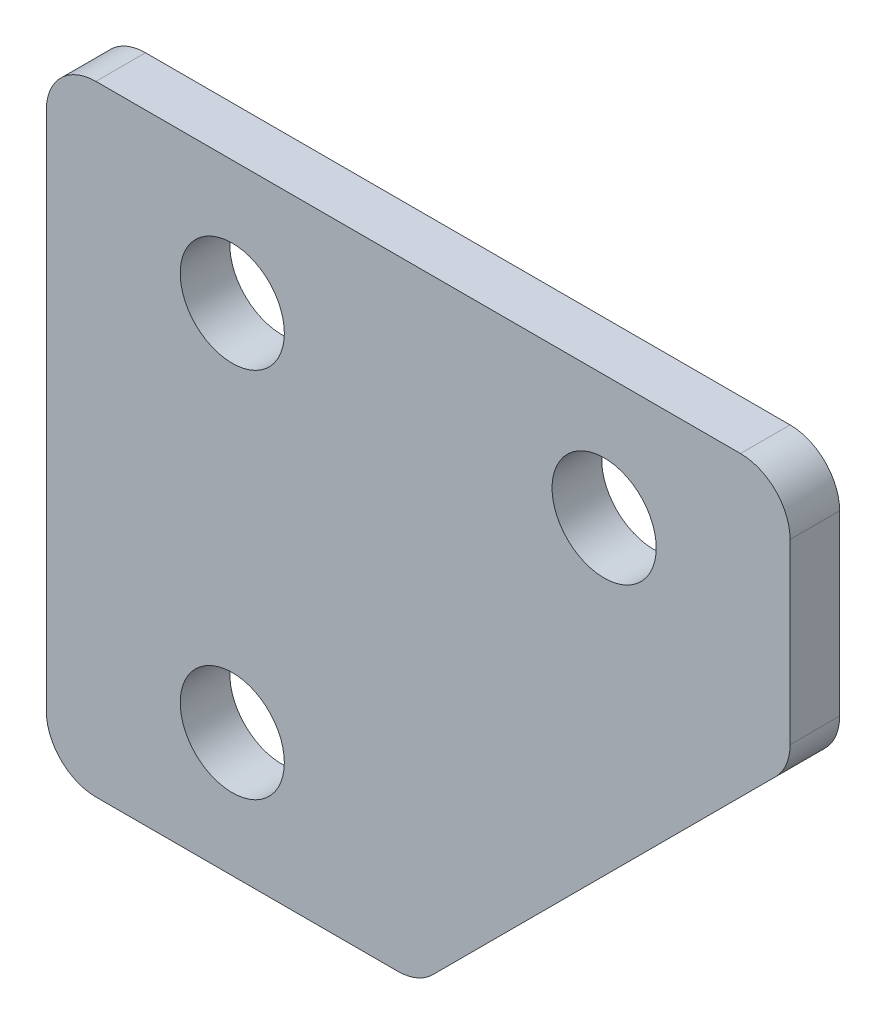
from build123d import *

# Parameters (mm, degrees)
SKETCH_1_W      = 15
SKETCH_1_H      = 25
SKETCH_1_R      = 2.1
SKETCH_1_H_2    = 10
EXTRUDE_1_DEPTH = 2
FILLET_1_R      = 2


with BuildPart() as part:
    # ｽｹｯﾁ1 → ﾎﾞｽ - 押し出し1 (new body)
    # profile 1 of 3: a face of its own
    with BuildSketch(Plane.XY):
        with Locations((0, -7.5)):
            Rectangle(SKETCH_1_W, SKETCH_1_H)
        with Locations((0, -15)):
            Circle(SKETCH_1_R, mode=Mode.SUBTRACT)
        Circle(SKETCH_1_R, mode=Mode.SUBTRACT)
    # profile 2 of 3: a face of its own
    with BuildSketch(Plane.XY):
        Polygon((7.5, -20), (22.5, -5), (7.5, -5), align=None)
    # profile 3 of 3: a face of its own
    with BuildSketch(Plane.XY):
        with Locations((15, 0)):
            Rectangle(SKETCH_1_W, SKETCH_1_H_2)
        with Locations((15, 0)):
            Circle(SKETCH_1_R, mode=Mode.SUBTRACT)
    extrude(amount=EXTRUDE_1_DEPTH)

    # ﾌｨﾚｯﾄ1
    fillet_1_edges = [part.edges().sort_by_distance(p)[0] for p in [
        (7.5, -20, 1),
        (-7.5, -20, 1),
        (-7.5, 5, 1),
        (22.5, 5, 1),
        (22.5, -5, 1),
    ]]
    fillet(fillet_1_edges, radius=FILLET_1_R)


solid = part.part
